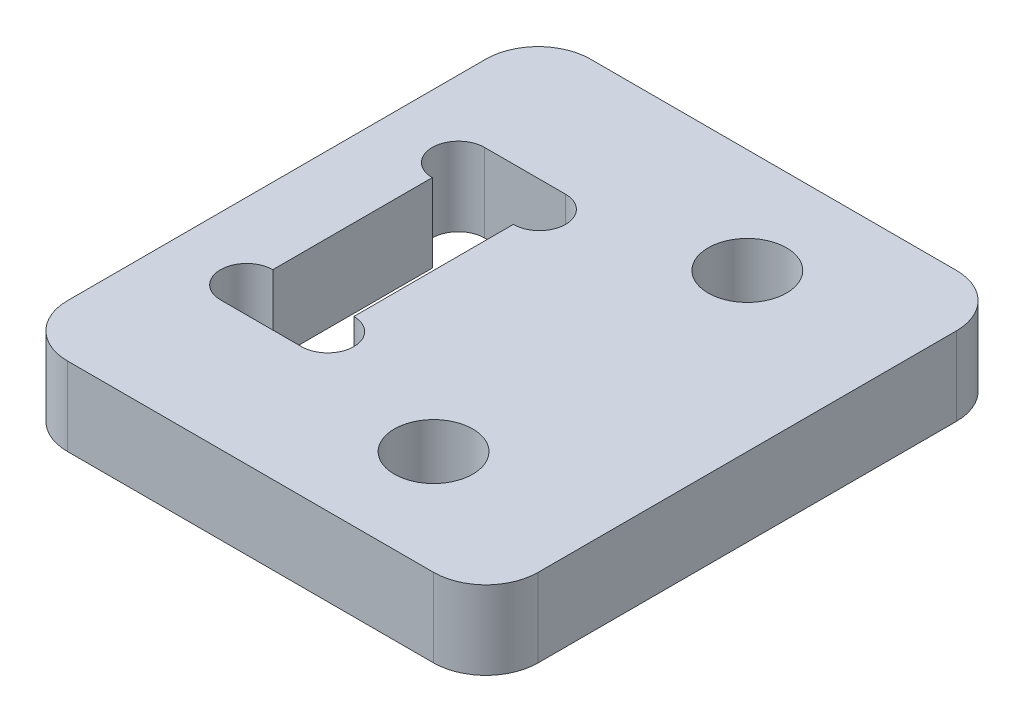
from build123d import *

# Parameters (mm, degrees)
SKETCH_1_R      = 1.5
EXTRUDE_1_DEPTH = 3
FILLET_1_R      = 2


with BuildPart() as part:
    # 草图1 → 凸台-拉伸1 (new body)
    with BuildSketch(Plane(origin=(0, 0, 0), x_dir=(1, 0, 0), z_dir=(0, 1, 0))):
        Polygon((-12, -10), (-6, -10), (6, -10), (6, 10), (-6, 10), (-12, 10), align=None)
        with Locations(Location((0, -6, 0), (0, 0, 270))):
            Circle(SKETCH_1_R, mode=Mode.SUBTRACT)
        with BuildLine():
            Line((-6, -5.05), (-9.1, -5.05))
            ThreePointArc((-9.1, -5.05), (-10.1, -4.05), (-9.1, -3.05))
            Line((-9.1, -3.05), (-9.1, 3.05))
            ThreePointArc((-9.1, 3.05), (-10.1, 4.05), (-9.1, 5.05))
            Line((-9.1, 5.05), (-6, 5.05))
            ThreePointArc((-6, 5.05), (-5.292893219, 4.757106781), (-5, 4.05))
            ThreePointArc((-5, 4.05), (-5.292893219, 3.342893219), (-6, 3.05))
            Line((-6, 3.05), (-6, -3.05))
            ThreePointArc((-6, -3.05), (-5.292893219, -3.342893219), (-5, -4.05))
            ThreePointArc((-5, -4.05), (-5.292893219, -4.757106781), (-6, -5.05))
        make_face(mode=Mode.SUBTRACT)
        with Locations(Location((0, 6, 0), (0, 0, 270))):
            Circle(SKETCH_1_R, mode=Mode.SUBTRACT)
    extrude(amount=EXTRUDE_1_DEPTH)

    # 圆角1
    fillet_1_edges = [part.edges().sort_by_distance(p)[0] for p in [
        (6, 1.5, -10),
        (6, 1.5, 10),
        (-12, 1.5, 10),
        (-12, 1.5, -10),
    ]]
    fillet(fillet_1_edges, radius=FILLET_1_R)


solid = part.part
